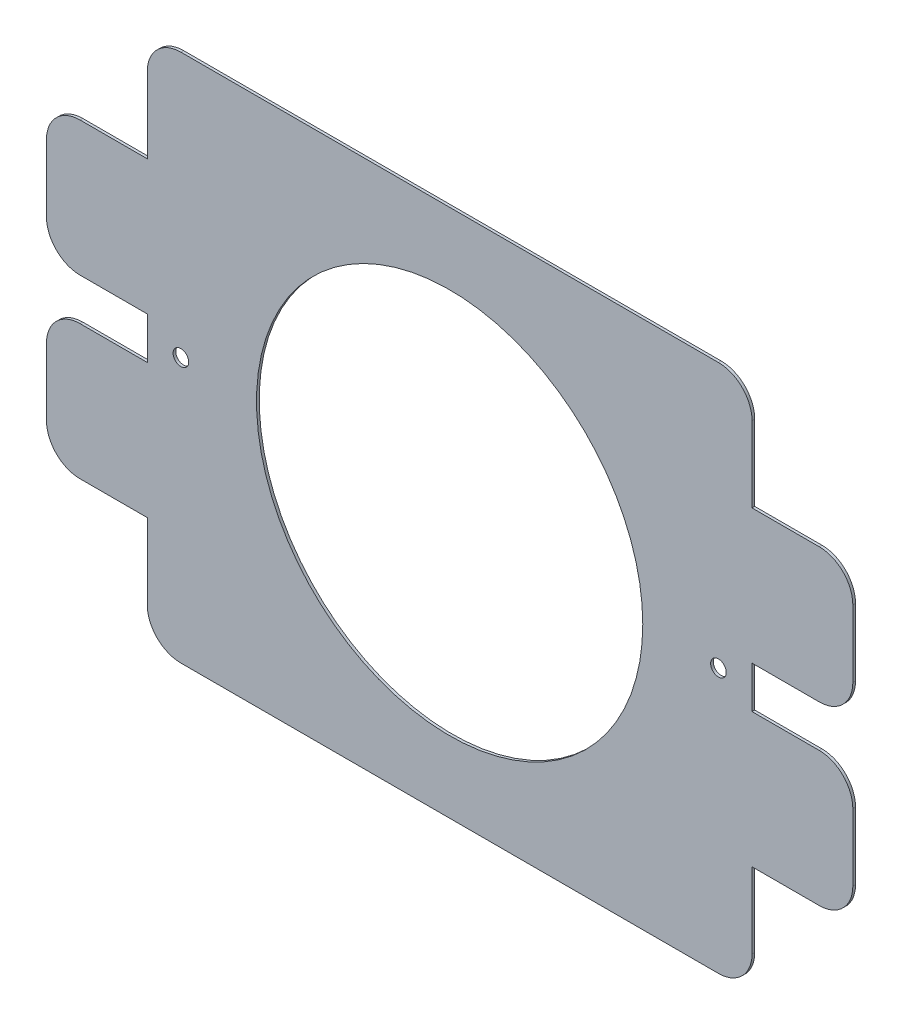
from build123d import *

# Parameters (mm, degrees)
SKETCH2_W           = 114.3
SKETCH2_H           = 100
SKETCH2_R           = 1.475
SKETCH2_R_2         = 36.5
SKETCH2_W_2         = 19.05
SKETCH2_H_2         = 25.4
BOSS_EXTRUDE1_DEPTH = 0.508
FILLET1_R           = 6.35


with BuildPart() as part:
    # Sketch2 → Boss-Extrude1 (new body)
    # profile 1 of 5: a face of its own
    with BuildSketch(Plane.XY):
        Rectangle(SKETCH2_W, SKETCH2_H)
        with Locations((50.8, 0)):
            Circle(SKETCH2_R, mode=Mode.SUBTRACT)
        with Locations((-50.8, 0)):
            Circle(SKETCH2_R, mode=Mode.SUBTRACT)
        Circle(SKETCH2_R_2, mode=Mode.SUBTRACT)
    # profile 2 of 5: a face of its own
    with BuildSketch(Plane.XY):
        with Locations((-66.675, 16.666666667)):
            Rectangle(SKETCH2_W_2, SKETCH2_H_2)
    # profile 3 of 5: a face of its own
    with BuildSketch(Plane.XY):
        with Locations((-66.675, -16.666666667)):
            Rectangle(SKETCH2_W_2, SKETCH2_H_2)
    # profile 4 of 5: a face of its own
    with BuildSketch(Plane.XY):
        with Locations((66.675, 16.666666667)):
            Rectangle(SKETCH2_W_2, SKETCH2_H_2)
    # profile 5 of 5: a face of its own
    with BuildSketch(Plane.XY):
        with Locations((66.675, -16.666666667)):
            Rectangle(SKETCH2_W_2, SKETCH2_H_2)
    extrude(amount=BOSS_EXTRUDE1_DEPTH)

    # Fillet1
    fillet1_edges = [part.edges().sort_by_distance(p)[0] for p in [
        (76.2, 29.366666667, 0.254),
        (76.2, 3.966666667, 0.254),
        (76.2, -3.966666667, 0.254),
        (76.2, -29.366666667, 0.254),
        (57.15, -50, 0.254),
        (-57.15, -50, 0.254),
        (-76.2, -29.366666667, 0.254),
        (-76.2, -3.966666667, 0.254),
        (-76.2, 3.966666667, 0.254),
        (-76.2, 29.366666667, 0.254),
        (-57.15, 50, 0.254),
        (57.15, 50, 0.254),
    ]]
    fillet(fillet1_edges, radius=FILLET1_R)


solid = part.part
